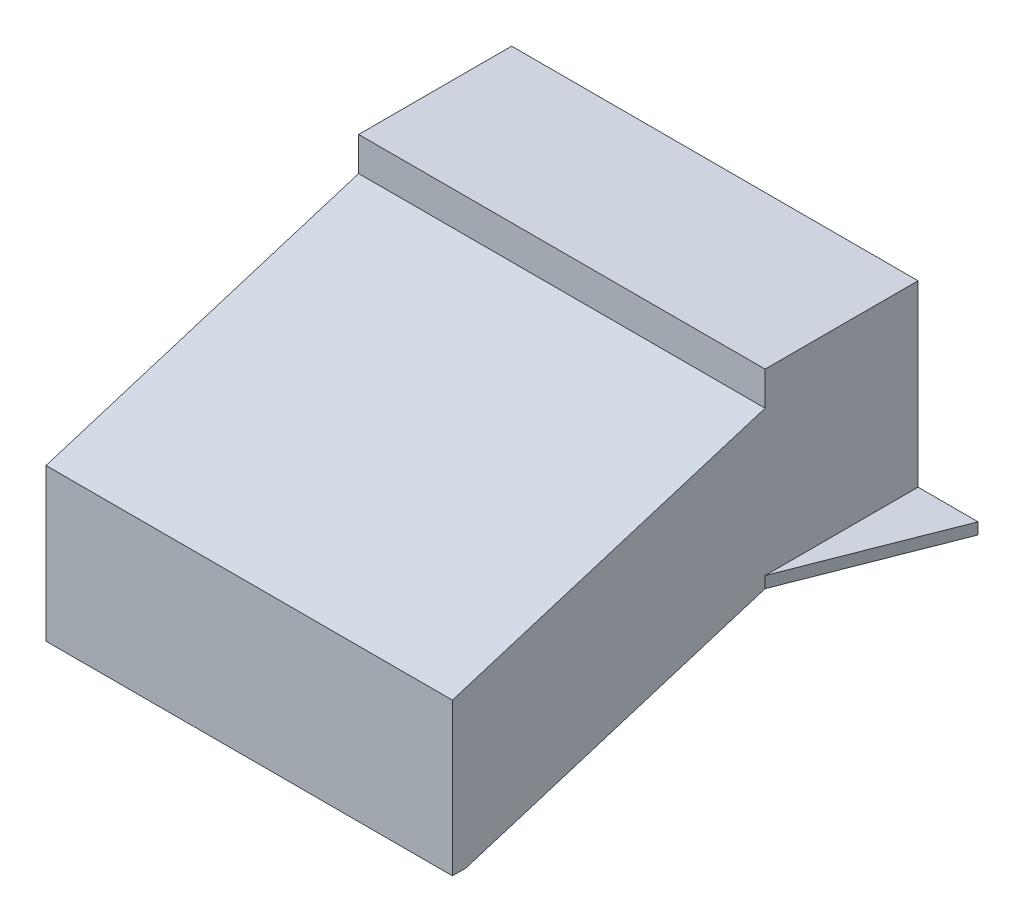
from build123d import *

# Parameters (mm, degrees)
SKETCH2_W            = 91
SKETCH2_H            = 67
BOSS_EXTRUDE10_DEPTH = 55.68
CUT_EXTRUDE13_DEPTH  = 99
CUT_EXTRUDE14_DEPTH  = 99
SKETCH28_W           = 87
SKETCH28_H           = 97.65285099
CUT_EXTRUDE16_DEPTH  = 31
SKETCH29_W           = 91
SKETCH29_H           = 35
BOSS_EXTRUDE12_DEPTH = 34.25
SKETCH30_W           = 87
SKETCH30_H           = 34.25
CUT_EXTRUDE18_DEPTH  = 32.44
SKETCH31_W           = 34.25
SKETCH31_H           = 2.550055223
BOSS_EXTRUDE13_DEPTH = 13.42
SKETCH32_W           = 34.25
SKETCH32_H           = 2.55894211
BOSS_EXTRUDE14_DEPTH = 13.42
CUT_EXTRUDE19_DEPTH  = 13.42
CUT_EXTRUDE20_DEPTH  = 13.42
SKETCH35_W           = 91
SKETCH35_H           = 35
BOSS_EXTRUDE15_DEPTH = 3
CUT_EXTRUDE21_DEPTH  = 99
SKETCH38_W           = 91
SKETCH38_H           = 34.25
BOSS_EXTRUDE16_DEPTH = 7.58
SKETCH40_W           = 87
SKETCH40_H           = 31.930310383
CUT_EXTRUDE23_DEPTH  = 7.13


with BuildPart() as part:
    # Sketch2 → Boss-Extrude10 (new body)
    with BuildSketch(Plane(origin=(0, 0, 0), x_dir=(1, 0, 0), z_dir=(0, 1, 0))):
        with Locations((45.5, 33.5)):
            Rectangle(SKETCH2_W, SKETCH2_H)
    extrude(amount=BOSS_EXTRUDE10_DEPTH)

    # Sketch24 → Cut-Extrude13 (cut)
    with BuildSketch(Plane.ZY):
        Polygon((-67, 0), (-67, 20.68), (0, 0), align=None)
    extrude(amount=-CUT_EXTRUDE13_DEPTH, mode=Mode.SUBTRACT)

    # Sketch26 → Cut-Extrude14 (cut)
    with BuildSketch(Plane.ZY):
        Polygon((0, 55.68), (0, 35), (-67, 55.68), align=None)
    extrude(amount=-CUT_EXTRUDE14_DEPTH, mode=Mode.SUBTRACT)

    # Sketch28 → Cut-Extrude16 (cut)
    with BuildSketch(Plane(origin=(0, 0, 0), x_dir=(-1, 0, 0), z_dir=(0, -0.955519618566905, -0.2949275479397551))):
        with Locations((-45.5, 48.826425495)):
            Rectangle(SKETCH28_W, SKETCH28_H)
    extrude(amount=-CUT_EXTRUDE16_DEPTH, mode=Mode.SUBTRACT)

    # Sketch29 → Boss-Extrude12 (add)
    with BuildSketch(Plane(origin=(0, 0, -67), x_dir=(-1, 0, 0), z_dir=(0, 0, -1))):
        with Locations((-45.5, 38.18)):
            Rectangle(SKETCH29_W, SKETCH29_H)
    extrude(amount=BOSS_EXTRUDE12_DEPTH)

    # Sketch30 → Cut-Extrude18 (cut)
    with BuildSketch(Plane.XZ.offset(-20.68)):
        with Locations((45.5, -84.125)):
            Rectangle(SKETCH30_W, SKETCH30_H)
    extrude(amount=-CUT_EXTRUDE18_DEPTH, mode=Mode.SUBTRACT)

    # Sketch31 → Boss-Extrude13 (add)
    with BuildSketch(Plane.ZY):
        with Locations((-84.125, 21.955027612)):
            Rectangle(SKETCH31_W, SKETCH31_H)
    extrude(amount=BOSS_EXTRUDE13_DEPTH)

    # Sketch32 → Boss-Extrude14 (add)
    with BuildSketch(Plane(origin=(91, 0, 0), x_dir=(0, 0, -1), z_dir=(1, 0, 0))):
        with Locations((84.125, 21.959471055)):
            Rectangle(SKETCH32_W, SKETCH32_H)
    extrude(amount=BOSS_EXTRUDE14_DEPTH)

    # Sketch33 → Cut-Extrude19 (cut)
    with BuildSketch(Plane(origin=(0, 23.230055223, 0), x_dir=(1, 0, 0), z_dir=(0, 1, 0))):
        Polygon((-13.42, 101.25), (0, 67), (-13.42, 67), align=None)
    extrude(amount=-CUT_EXTRUDE19_DEPTH, mode=Mode.SUBTRACT)

    # Sketch34 → Cut-Extrude20 (cut)
    with BuildSketch(Plane(origin=(0, 23.23894211, 0), x_dir=(1, 0, 0), z_dir=(0, 1, 0))):
        Polygon((91, 67), (104.42, 101.25), (104.42, 67), align=None)
    extrude(amount=-CUT_EXTRUDE20_DEPTH, mode=Mode.SUBTRACT)

    # Sketch35 → Boss-Extrude15 (add)
    with BuildSketch(Plane.XY):
        with Locations((45.5, 17.5)):
            Rectangle(SKETCH35_W, SKETCH35_H)
    extrude(amount=BOSS_EXTRUDE15_DEPTH)

    # Sketch36 → Cut-Extrude21 (cut)
    with BuildSketch(Plane.ZY):
        Polygon((0, 35), (3, 34.074029851), (3, 35), align=None)
    extrude(amount=-CUT_EXTRUDE21_DEPTH, mode=Mode.SUBTRACT)

    # Sketch38 → Boss-Extrude16 (add)
    with BuildSketch(Plane(origin=(0, 55.68, 0), x_dir=(1, 0, 0), z_dir=(0, 1, 0))):
        with Locations((45.5, 84.125)):
            Rectangle(SKETCH38_W, SKETCH38_H)
    extrude(amount=BOSS_EXTRUDE16_DEPTH)

    # Sketch40 → Cut-Extrude23 (cut)
    with BuildSketch(Plane.XZ.offset(-53.12)):
        with Locations((45.5, -85.284844808)):
            Rectangle(SKETCH40_W, SKETCH40_H)
    extrude(amount=-CUT_EXTRUDE23_DEPTH, mode=Mode.SUBTRACT)


solid = part.part
